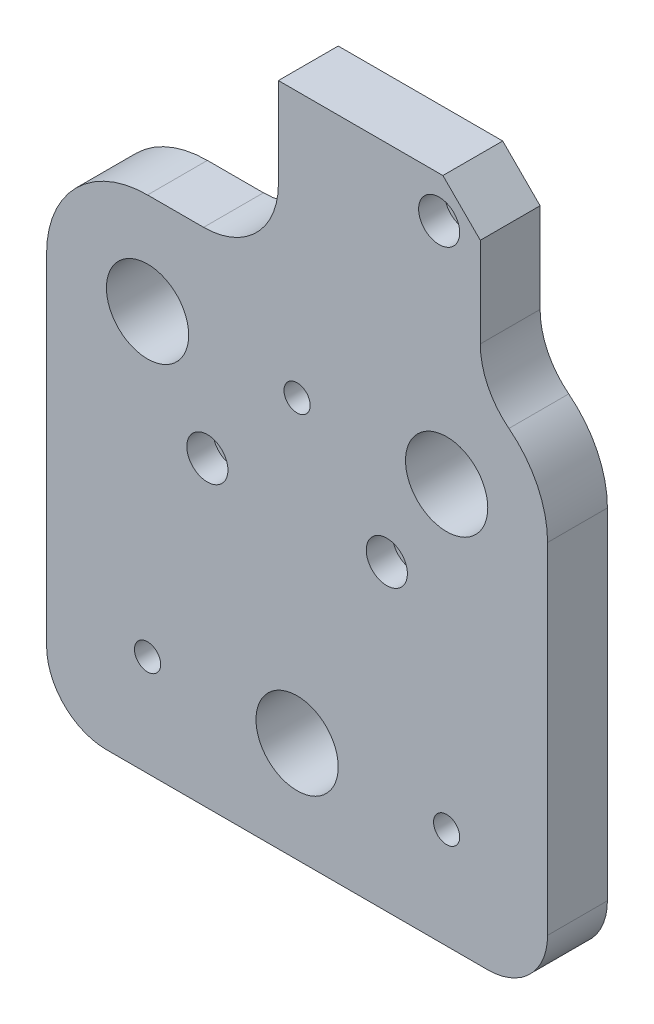
from build123d import *

# Parameters (mm, degrees)
ESBO_O7_R                = 1.65
RESSALTO_EXTRUS_O5_DEPTH = 8
RESSALTO_EXTRUS_O6_START = -8
ESBO_O10_R               = 1.65
RESSALTO_EXTRUS_O6_DEPTH = 8
ESBO_O8_R                = 5.5
CORTE_EXTRUS_O4_DEPTH    = 8
FILETE1_R                = 10
ESBO_O11_R               = 2.75
CORTE_EXTRUS_O5_DEPTH    = 3.5
ESBO_O14_R               = 1.75
CORTE_EXTRUS_O9_DEPTH    = 8
CORTE_EXTRUS_O10_DEPTH   = 4.9


with BuildPart() as part:
    # Esboço7 → Ressalto-extrusão5 (new body)
    with BuildSketch(Plane.XY):
        Polygon((-45.692156379, 16.70804449), (-45.692156379, -36.79195551), (6.807843621, -36.79195551), (6.807843621, 4.155908866), (3.801241904, 7.162510584), (3.84677581, 7.20804449), (3.807843621, 7.20804449), (3.807843621, 44.20804449), (-1.192156379, 49.20804449), (-23.192156379, 49.20804449), (-23.192156379, 16.70804449), align=None)
        with Locations((-1.692156379, 43.70804449)):
            Circle(ESBO_O7_R, mode=Mode.SUBTRACT)
        with Locations((-32.692156379, 0.70804449)):
            Circle(ESBO_O7_R, mode=Mode.SUBTRACT)
        with Locations((-8.692156379, 0.70804449)):
            Circle(ESBO_O7_R, mode=Mode.SUBTRACT)
    extrude(amount=RESSALTO_EXTRUS_O5_DEPTH)

    # Esboço10 → Ressalto-extrusão6 (add)
    with BuildSketch(Plane.XY.offset(8).offset(RESSALTO_EXTRUS_O6_START)):
        with BuildLine():
            Line((12.807843621, 13.70804449), (12.807843621, -31.79195551))
            ThreePointArc((12.807843621, -31.79195551), (10.464697871, -37.44880976), (4.807843621, -39.79195551))
            Line((4.807843621, -39.79195551), (-46.192156379, -39.79195551))
            ThreePointArc((-46.192156379, -39.79195551), (-51.849010628, -37.44880976), (-54.192156379, -31.79195551))
            Line((-54.192156379, -31.79195551), (-54.192156379, 13.70804449))
            ThreePointArc((-54.192156379, 13.70804449), (-50.238097925, 23.253986036), (-40.692156379, 27.20804449))
            Line((-40.692156379, 27.20804449), (-0.692156379, 27.20804449))
            ThreePointArc((-0.692156379, 27.20804449), (8.853785167, 23.253986036), (12.807843621, 13.70804449))
        make_face()
        with Locations((-8.692156379, 0.70804449)):
            Circle(ESBO_O10_R, mode=Mode.SUBTRACT)
        with Locations((-32.692156379, 0.70804449)):
            Circle(ESBO_O10_R, mode=Mode.SUBTRACT)
    extrude(amount=RESSALTO_EXTRUS_O6_DEPTH)

    # Esboço8 → Corte-extrusão4 (cut)
    with BuildSketch(Plane.XY.offset(8)):
        with Locations((-40.692156379, 13.70804449)):
            Circle(ESBO_O8_R)
        with Locations((-0.692156379, 13.70804449)):
            Circle(ESBO_O8_R)
        with Locations((-20.692156379, -26.29195551)):
            Circle(ESBO_O8_R)
    extrude(amount=-CORTE_EXTRUS_O4_DEPTH, mode=Mode.SUBTRACT)

    # Filete1
    filete1_edges = [part.edges().sort_by_distance(p)[0] for p in [
        (-23.192156379, 27.20804449, 4),
        (3.807843621, 26.435966551, 4),
    ]]
    fillet(filete1_edges, radius=FILETE1_R)

    # Esboço11 → Corte-extrusão5 (cut)
    with BuildSketch(Plane.XY.offset(8)):
        with Locations((-32.692156379, 0.70804449)):
            Circle(ESBO_O11_R)
        with Locations((-8.692156379, 0.70804449)):
            Circle(ESBO_O11_R)
        with Locations((-1.692156379, 43.70804449)):
            Circle(ESBO_O11_R)
    extrude(amount=-CORTE_EXTRUS_O5_DEPTH, mode=Mode.SUBTRACT)

    # Esboço14 → Corte-extrusão9 (cut)
    with BuildSketch(Plane.XY.offset(8)):
        with Locations((-20.692156379, 13.70804449)):
            Circle(ESBO_O14_R)
        with Locations((-40.692156379, -26.29195551)):
            Circle(ESBO_O14_R)
        with Locations((-0.692156379, -26.29195551)):
            Circle(ESBO_O14_R)
    extrude(amount=-CORTE_EXTRUS_O9_DEPTH, mode=Mode.SUBTRACT)

    # Esboço15 → Corte-extrusão10 (cut)
    with BuildSketch(Plane(origin=(0, 0, 0), x_dir=(-1, 0, 0), z_dir=(0, 0, -1))):
        Polygon((23.867582859, 13.70804449), (22.279869619, 16.45804449), (19.104443138, 16.45804449), (17.516729898, 13.70804449), (19.104443138, 10.95804449), (22.279869619, 10.95804449), align=None)
        Polygon((3.867582859, -26.29195551), (2.279869619, -23.54195551), (-0.895556862, -23.54195551), (-2.483270102, -26.29195551), (-0.895556862, -29.04195551), (2.279869619, -29.04195551), align=None)
        Polygon((43.867582859, -26.29195551), (42.279869619, -23.54195551), (39.104443138, -23.54195551), (37.516729898, -26.29195551), (39.104443138, -29.04195551), (42.279869619, -29.04195551), align=None)
    extrude(amount=-CORTE_EXTRUS_O10_DEPTH, mode=Mode.SUBTRACT)


solid = part.part
